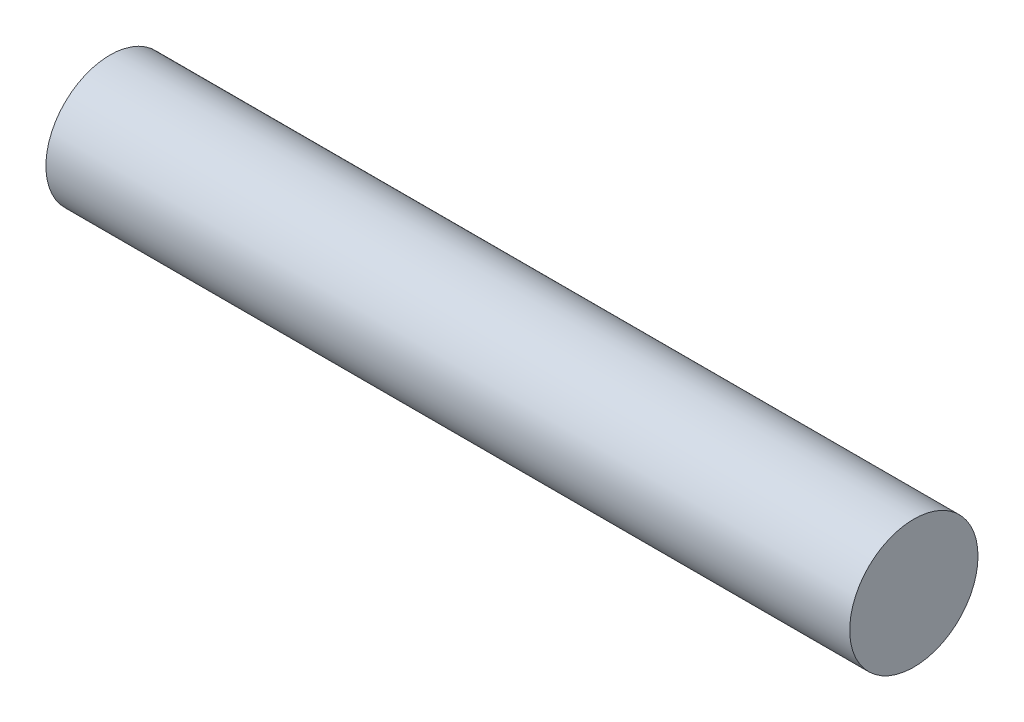
from build123d import *

# Parameters (mm, degrees)
SKETCH1_R           = 1.995
BOSS_EXTRUDE1_DEPTH = 25


with BuildPart() as part:
    # Sketch1 → Boss-Extrude1 (new body)
    with BuildSketch(Plane(origin=(0, 0, 0), x_dir=(0, 0, -1), z_dir=(1, 0, 0))):
        Circle(SKETCH1_R)
    extrude(amount=BOSS_EXTRUDE1_DEPTH)


solid = part.part
